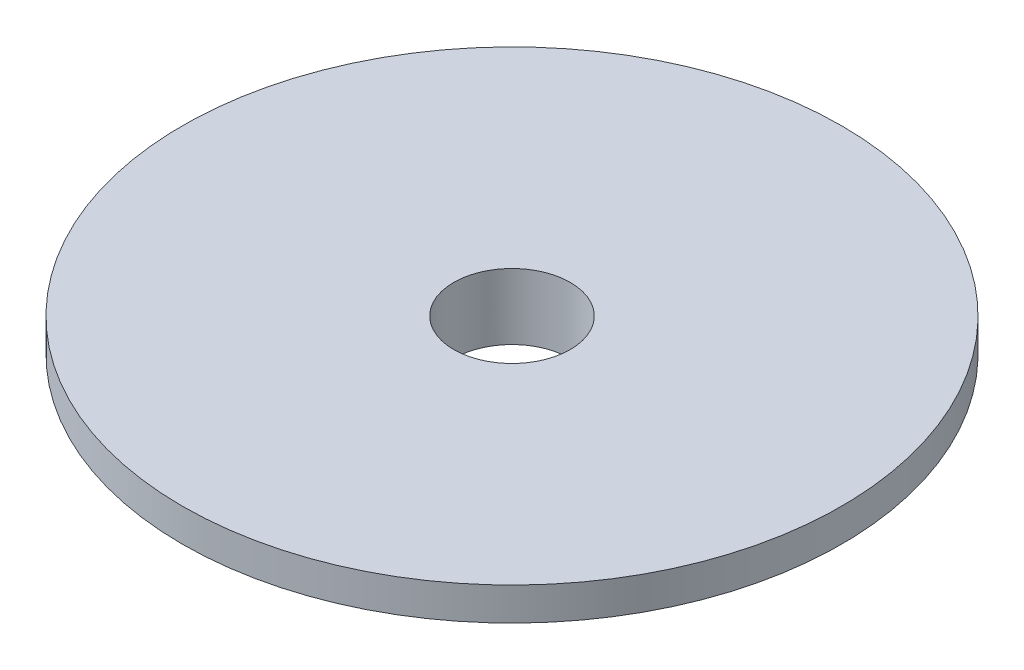
from build123d import *
from build123d.topology import SkipClean

# Parameters (mm, degrees)
SKETCH_1_R      = 15
SKETCH_1_R_2    = 2.65
EXTRUDE_1_DEPTH = 1.5
EXTRUDE_START   = 1.5
SKETCH_2_R      = 6
SKETCH_2_R_2    = 2.65
EXTRUDE_3_DEPTH = 1.5


with BuildPart() as part:
    # 草图1 → 凸台-拉伸1 (new body)
    with BuildSketch(Plane(origin=(0, 0, 0), x_dir=(1, 0, 0), z_dir=(0, 1, 0))):
        with Locations(Location((0, 0, 0), (0, 0, 270))):
            Circle(SKETCH_1_R)
        with Locations(Location((0, 0, 0), (0, 0, 270))):
            Circle(SKETCH_1_R_2, mode=Mode.SUBTRACT)
    extrude(amount=EXTRUDE_1_DEPTH)

    # 草图2 → 凸台-拉伸3 (add)
    with SkipClean():  # the faces are left unmerged after this step: merging them gives an invalid solid
        with BuildSketch(Plane.XZ.offset(EXTRUDE_START)):
            with Locations(Location((0, 0, 0), (0, 0, 90))):
                Circle(SKETCH_2_R)
            with Locations(Location((0, 0, 0), (0, 0, 270))):
                Circle(SKETCH_2_R_2, mode=Mode.SUBTRACT)
        extrude(amount=-EXTRUDE_3_DEPTH)


solid = part.part
